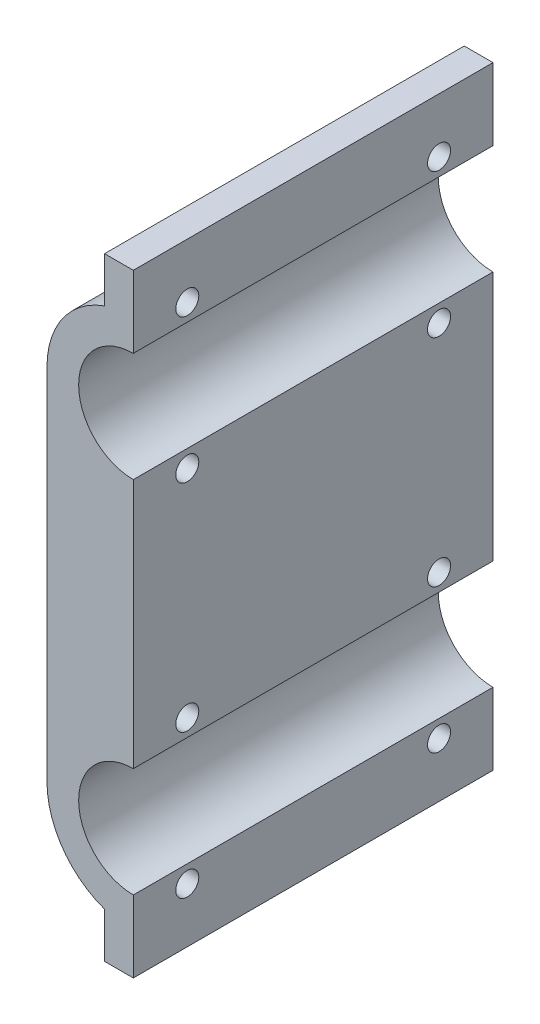
from build123d import *

# Parameters (mm, degrees)
RESSALTO_EXTRUS_O1_DEPTH        = 50
ESBO_O2_R                       = 1.6
CORTE_EXTRUS_O1_DEPTH           = 67.773947015
CORTE_EXTRUS_O2_DEPTH           = 8
CORTE_EXTRUS_O2_DRAFT           = -2
CORTE_EXTRUS_O2_PROFILE_2_DEPTH = 8
CORTE_EXTRUS_O2_PROFILE_2_DRAFT = -2
CORTE_EXTRUS_O2_PROFILE_3_DEPTH = 8
CORTE_EXTRUS_O2_PROFILE_3_DRAFT = -2
CORTE_EXTRUS_O2_PROFILE_4_DEPTH = 8
CORTE_EXTRUS_O2_PROFILE_4_DRAFT = -2
CORTE_EXTRUS_O2_PROFILE_5_DEPTH = 8
CORTE_EXTRUS_O2_PROFILE_5_DRAFT = -2
CORTE_EXTRUS_O2_PROFILE_6_DEPTH = 8
CORTE_EXTRUS_O2_PROFILE_6_DRAFT = -2
CORTE_EXTRUS_O2_PROFILE_7_DEPTH = 8
CORTE_EXTRUS_O2_PROFILE_7_DRAFT = -2
CORTE_EXTRUS_O2_PROFILE_8_DEPTH = 8
CORTE_EXTRUS_O2_PROFILE_8_DRAFT = -2


with BuildPart() as part:
    # Esboço1 → Ressalto-extrusão1 (new body)
    with BuildSketch(Plane.XY):
        with BuildLine():
            Line((0, 17.4), (0, -17.4))
            ThreePointArc((0, -17.4), (-7.6, -25), (0, -32.6))
            Line((0, -32.6), (0, -42.6))
            Line((0, -42.6), (-4, -42.6))
            Line((-4, -42.6), (-4, -36.313708499))
            ThreePointArc((-4, -36.313708499), (-9.797958971, -31.92820323), (-12, -25))
            Line((-12, -25), (-12, 25))
            ThreePointArc((-12, 25), (-9.797958971, 31.92820323), (-4, 36.313708499))
            Line((-4, 36.313708499), (-4, 42.6))
            Line((-4, 42.6), (0, 42.6))
            Line((0, 42.6), (0, 32.6))
            ThreePointArc((0, 32.6), (-7.6, 25), (0, 17.4))
        make_face()
    extrude(amount=RESSALTO_EXTRUS_O1_DEPTH)

    # Esboço2 → Corte-extrusão1 (cut, through all)
    with BuildSketch(Plane(origin=(0, 0, 0), x_dir=(0, 0, -1), z_dir=(1, 0, 0))):
        with Locations(Location((-42.5, 35, 0), (0, 0, 90))):
            Circle(ESBO_O2_R)
        with Locations(Location((-7.5, 35, 0), (0, 0, 90))):
            Circle(ESBO_O2_R)
        with Locations(Location((-7.5, -35, 0), (0, 0, 90))):
            Circle(ESBO_O2_R)
        with Locations(Location((-42.5, -35, 0), (0, 0, 90))):
            Circle(ESBO_O2_R)
        with Locations(Location((-42.5, -15, 0), (0, 0, 90))):
            Circle(ESBO_O2_R)
        with Locations(Location((-42.5, 15, 0), (0, 0, 90))):
            Circle(ESBO_O2_R)
        with Locations(Location((-7.5, 15, 0), (0, 0, 90))):
            Circle(ESBO_O2_R)
        with Locations(Location((-7.5, -15, 0), (0, 0, 90))):
            Circle(ESBO_O2_R)
    extrude(amount=-CORTE_EXTRUS_O1_DEPTH, mode=Mode.SUBTRACT)


with BuildPart() as corte_extrus_o2_tool:
    # Esboço3 → Corte-extrusão2 (with draft: the straight prism first)
    with BuildSketch(Plane.ZY.offset(12)):
        Polygon((10.25, 36.58771324), (7.5, 38.175426481), (4.75, 36.58771324), (4.75, 33.41228676), (7.5, 31.824573519), (10.25, 33.41228676), align=None)
    extrude(amount=-CORTE_EXTRUS_O2_DEPTH)
    # Corte-extrusão2: the draft: its side faces are tilted about the plane it starts from
    corte_extrus_o2_sides = [corte_extrus_o2_tool.faces().sort_by_distance(p)[0] for p in [
        (-8, 37.38156986, 8.875),
        (-8, 37.38156986, 6.125),
        (-8, 35, 4.75),
        (-8, 32.61843014, 6.125),
        (-8, 32.61843014, 8.875),
        (-8, 35, 10.25),
    ]]
    draft(corte_extrus_o2_sides, Plane.ZY.offset(12), CORTE_EXTRUS_O2_DRAFT)


with BuildPart() as part_1:
    add(part.part)

    # Corte-extrusão2: cut by corte_extrus_o2_tool
    add(corte_extrus_o2_tool.part, mode=Mode.SUBTRACT)


with BuildPart() as corte_extrus_o2_profile_2_tool:
    # Esboço3 → Corte-extrusão2 profile 2 (with draft: the straight prism first)
    with BuildSketch(Plane.ZY.offset(12)):
        Polygon((45.25, 36.58771324), (42.5, 38.175426481), (39.75, 36.58771324), (39.75, 33.41228676), (42.5, 31.824573519), (45.25, 33.41228676), align=None)
    extrude(amount=-CORTE_EXTRUS_O2_PROFILE_2_DEPTH)
    # Corte-extrusão2 profile 2: the draft: its side faces are tilted about the plane it starts from
    corte_extrus_o2_profile_2_sides = [corte_extrus_o2_profile_2_tool.faces().sort_by_distance(p)[0] for p in [
        (-8, 37.38156986, 43.875),
        (-8, 37.38156986, 41.125),
        (-8, 35, 39.75),
        (-8, 32.61843014, 41.125),
        (-8, 32.61843014, 43.875),
        (-8, 35, 45.25),
    ]]
    draft(corte_extrus_o2_profile_2_sides, Plane.ZY.offset(12), CORTE_EXTRUS_O2_PROFILE_2_DRAFT)


with BuildPart() as part_2:
    add(part_1.part)

    # Corte-extrusão2 profile 2: cut by corte_extrus_o2_profile_2_tool
    add(corte_extrus_o2_profile_2_tool.part, mode=Mode.SUBTRACT)


with BuildPart() as corte_extrus_o2_profile_3_tool:
    # Esboço3 → Corte-extrusão2 profile 3 (with draft: the straight prism first)
    with BuildSketch(Plane.ZY.offset(12)):
        Polygon((45.25, 16.58771324), (42.5, 18.175426481), (39.75, 16.58771324), (39.75, 13.41228676), (42.5, 11.824573519), (45.25, 13.41228676), align=None)
    extrude(amount=-CORTE_EXTRUS_O2_PROFILE_3_DEPTH)
    # Corte-extrusão2 profile 3: the draft: its side faces are tilted about the plane it starts from
    corte_extrus_o2_profile_3_sides = [corte_extrus_o2_profile_3_tool.faces().sort_by_distance(p)[0] for p in [
        (-8, 17.38156986, 43.875),
        (-8, 17.38156986, 41.125),
        (-8, 15, 39.75),
        (-8, 12.61843014, 41.125),
        (-8, 12.61843014, 43.875),
        (-8, 15, 45.25),
    ]]
    draft(corte_extrus_o2_profile_3_sides, Plane.ZY.offset(12), CORTE_EXTRUS_O2_PROFILE_3_DRAFT)


with BuildPart() as part_3:
    add(part_2.part)

    # Corte-extrusão2 profile 3: cut by corte_extrus_o2_profile_3_tool
    add(corte_extrus_o2_profile_3_tool.part, mode=Mode.SUBTRACT)


with BuildPart() as corte_extrus_o2_profile_4_tool:
    # Esboço3 → Corte-extrusão2 profile 4 (with draft: the straight prism first)
    with BuildSketch(Plane.ZY.offset(12)):
        Polygon((10.25, 16.58771324), (7.5, 18.175426481), (4.75, 16.58771324), (4.75, 13.41228676), (7.5, 11.824573519), (10.25, 13.41228676), align=None)
    extrude(amount=-CORTE_EXTRUS_O2_PROFILE_4_DEPTH)
    # Corte-extrusão2 profile 4: the draft: its side faces are tilted about the plane it starts from
    corte_extrus_o2_profile_4_sides = [corte_extrus_o2_profile_4_tool.faces().sort_by_distance(p)[0] for p in [
        (-8, 17.38156986, 8.875),
        (-8, 17.38156986, 6.125),
        (-8, 15, 4.75),
        (-8, 12.61843014, 6.125),
        (-8, 12.61843014, 8.875),
        (-8, 15, 10.25),
    ]]
    draft(corte_extrus_o2_profile_4_sides, Plane.ZY.offset(12), CORTE_EXTRUS_O2_PROFILE_4_DRAFT)


with BuildPart() as part_4:
    add(part_3.part)

    # Corte-extrusão2 profile 4: cut by corte_extrus_o2_profile_4_tool
    add(corte_extrus_o2_profile_4_tool.part, mode=Mode.SUBTRACT)


with BuildPart() as corte_extrus_o2_profile_5_tool:
    # Esboço3 → Corte-extrusão2 profile 5 (with draft: the straight prism first)
    with BuildSketch(Plane.ZY.offset(12)):
        Polygon((10.25, -13.41228676), (7.5, -11.824573519), (4.75, -13.41228676), (4.75, -16.58771324), (7.5, -18.175426481), (10.25, -16.58771324), align=None)
    extrude(amount=-CORTE_EXTRUS_O2_PROFILE_5_DEPTH)
    # Corte-extrusão2 profile 5: the draft: its side faces are tilted about the plane it starts from
    corte_extrus_o2_profile_5_sides = [corte_extrus_o2_profile_5_tool.faces().sort_by_distance(p)[0] for p in [
        (-8, -12.61843014, 8.875),
        (-8, -12.61843014, 6.125),
        (-8, -15, 4.75),
        (-8, -17.38156986, 6.125),
        (-8, -17.38156986, 8.875),
        (-8, -15, 10.25),
    ]]
    draft(corte_extrus_o2_profile_5_sides, Plane.ZY.offset(12), CORTE_EXTRUS_O2_PROFILE_5_DRAFT)


with BuildPart() as part_5:
    add(part_4.part)

    # Corte-extrusão2 profile 5: cut by corte_extrus_o2_profile_5_tool
    add(corte_extrus_o2_profile_5_tool.part, mode=Mode.SUBTRACT)


with BuildPart() as corte_extrus_o2_profile_6_tool:
    # Esboço3 → Corte-extrusão2 profile 6 (with draft: the straight prism first)
    with BuildSketch(Plane.ZY.offset(12)):
        Polygon((10.25, -33.41228676), (7.5, -31.824573519), (4.75, -33.41228676), (4.75, -36.58771324), (7.5, -38.175426481), (10.25, -36.58771324), align=None)
    extrude(amount=-CORTE_EXTRUS_O2_PROFILE_6_DEPTH)
    # Corte-extrusão2 profile 6: the draft: its side faces are tilted about the plane it starts from
    corte_extrus_o2_profile_6_sides = [corte_extrus_o2_profile_6_tool.faces().sort_by_distance(p)[0] for p in [
        (-8, -32.61843014, 8.875),
        (-8, -32.61843014, 6.125),
        (-8, -35, 4.75),
        (-8, -37.38156986, 6.125),
        (-8, -37.38156986, 8.875),
        (-8, -35, 10.25),
    ]]
    draft(corte_extrus_o2_profile_6_sides, Plane.ZY.offset(12), CORTE_EXTRUS_O2_PROFILE_6_DRAFT)


with BuildPart() as part_6:
    add(part_5.part)

    # Corte-extrusão2 profile 6: cut by corte_extrus_o2_profile_6_tool
    add(corte_extrus_o2_profile_6_tool.part, mode=Mode.SUBTRACT)


with BuildPart() as corte_extrus_o2_profile_7_tool:
    # Esboço3 → Corte-extrusão2 profile 7 (with draft: the straight prism first)
    with BuildSketch(Plane.ZY.offset(12)):
        Polygon((45.25, -33.41228676), (42.5, -31.824573519), (39.75, -33.41228676), (39.75, -36.58771324), (42.5, -38.175426481), (45.25, -36.58771324), align=None)
    extrude(amount=-CORTE_EXTRUS_O2_PROFILE_7_DEPTH)
    # Corte-extrusão2 profile 7: the draft: its side faces are tilted about the plane it starts from
    corte_extrus_o2_profile_7_sides = [corte_extrus_o2_profile_7_tool.faces().sort_by_distance(p)[0] for p in [
        (-8, -32.61843014, 43.875),
        (-8, -32.61843014, 41.125),
        (-8, -35, 39.75),
        (-8, -37.38156986, 41.125),
        (-8, -37.38156986, 43.875),
        (-8, -35, 45.25),
    ]]
    draft(corte_extrus_o2_profile_7_sides, Plane.ZY.offset(12), CORTE_EXTRUS_O2_PROFILE_7_DRAFT)


with BuildPart() as part_7:
    add(part_6.part)

    # Corte-extrusão2 profile 7: cut by corte_extrus_o2_profile_7_tool
    add(corte_extrus_o2_profile_7_tool.part, mode=Mode.SUBTRACT)


with BuildPart() as corte_extrus_o2_profile_8_tool:
    # Esboço3 → Corte-extrusão2 profile 8 (with draft: the straight prism first)
    with BuildSketch(Plane.ZY.offset(12)):
        Polygon((45.25, -13.41228676), (42.5, -11.824573519), (39.75, -13.41228676), (39.75, -16.58771324), (42.5, -18.175426481), (45.25, -16.58771324), align=None)
    extrude(amount=-CORTE_EXTRUS_O2_PROFILE_8_DEPTH)
    # Corte-extrusão2 profile 8: the draft: its side faces are tilted about the plane it starts from
    corte_extrus_o2_profile_8_sides = [corte_extrus_o2_profile_8_tool.faces().sort_by_distance(p)[0] for p in [
        (-8, -12.61843014, 43.875),
        (-8, -12.61843014, 41.125),
        (-8, -15, 39.75),
        (-8, -17.38156986, 41.125),
        (-8, -17.38156986, 43.875),
        (-8, -15, 45.25),
    ]]
    draft(corte_extrus_o2_profile_8_sides, Plane.ZY.offset(12), CORTE_EXTRUS_O2_PROFILE_8_DRAFT)


with BuildPart() as part_8:
    add(part_7.part)

    # Corte-extrusão2 profile 8: cut by corte_extrus_o2_profile_8_tool
    add(corte_extrus_o2_profile_8_tool.part, mode=Mode.SUBTRACT)


solid = part_8.part
